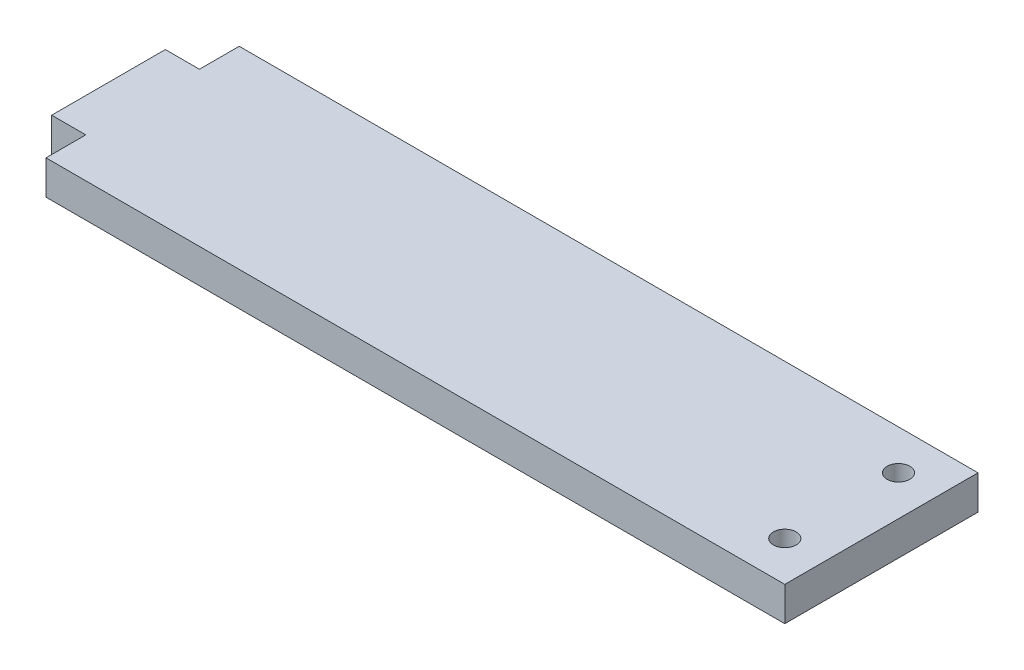
from build123d import *

# Parameters (mm, degrees)
BOSS_EXTRU_1_DEPTH      = 6
ESQUISSE3_R             = 2
ENL_V_MAT_EXTRU_2_DEPTH = 10
ESQUISSE5_R             = 2
ENL_V_MAT_EXTRU_3_DEPTH = 355.348418967


with BuildPart() as part:
    # Esquisse2 → Boss.-Extru.1 (new body)
    with BuildSketch(Plane(origin=(0, 0, 0), x_dir=(1, 0, 0), z_dir=(0, 1, 0))):
        Polygon((-347.889533646, 17), (-217.889533646, 17), (-217.889533646, -17), (-347.889533646, -17), (-347.889533646, -10), (-353.889533646, -10), (-353.889533646, 10), (-347.889533646, 10), align=None)
    extrude(amount=BOSS_EXTRU_1_DEPTH)

    # Esquisse3 → Enlèv. mat.-Extru.2 (cut)
    with BuildSketch(Plane.ZY.offset(347.889533646)):
        with Locations((-13.5, 3)):
            Circle(ESQUISSE3_R)
        with Locations((13.5, 3)):
            Circle(ESQUISSE3_R)
    extrude(amount=-ENL_V_MAT_EXTRU_2_DEPTH, mode=Mode.SUBTRACT)

    # Esquisse5 → Enlèv. mat.-Extru.3 (cut, through all)
    with BuildSketch(Plane(origin=(0, 6, 0), x_dir=(1, 0, 0), z_dir=(0, 1, 0))):
        with Locations(Location((-224.889533646, 10, 0), (0, 0, 270))):
            Circle(ESQUISSE5_R)
        with Locations(Location((-224.889533646, -10, 0), (0, 0, 90))):
            Circle(ESQUISSE5_R)
    extrude(amount=-ENL_V_MAT_EXTRU_3_DEPTH, mode=Mode.SUBTRACT)


solid = part.part
